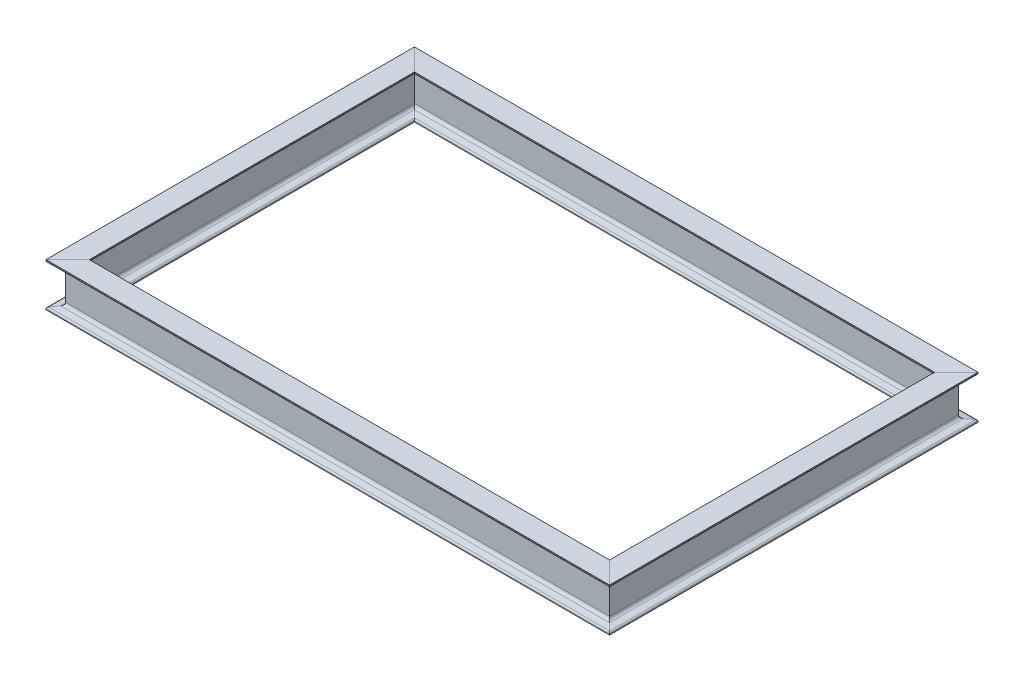
from build123d import *

# Parameters (mm, degrees)
SB_BEAM_100_X_8_1_DEPTH      = 856.901699437
SB_BEAM_100_X_8_1_DEPTH_BACK = 56.901699437
SB_BEAM_100_X_8_1_2_DEPTH    = 1363.803398875
SB_BEAM_100_X_8_1_3_DEPTH    = 913.803398875
SB_BEAM_100_X_8_1_4_DEPTH    = 1363.803398875


with BuildPart() as part:
    # Sketch11 → Sb beam 100 X 8(1) (new, two sides: drawn at the far end of the back side and taken through both)
    with BuildSketch(Plane(origin=(-625, 0, -400), x_dir=(1, 0, 0), z_dir=(0, 0, 1)).offset(-SB_BEAM_100_X_8_1_DEPTH_BACK)):
        with BuildLine():
            Line((-25, -50), (-25, -48.060671023))
            ThreePointArc((-25, -48.060671023), (-24.17058332, -45.798374682), (-22.075437296, -44.608299096))
            Line((-22.075437296, -44.608299096), (-8.099125408, -42.278743853))
            ThreePointArc((-8.099125408, -42.278743853), (-3.90883336, -39.898592681), (-2.25, -35.374))
            Line((-2.25, -35.374), (-2.25, 35.374))
            ThreePointArc((-2.25, 35.374), (-3.90883336, 39.898592681), (-8.099125408, 42.278743853))
            Line((-8.099125408, 42.278743853), (-22.075437296, 44.608299096))
            ThreePointArc((-22.075437296, 44.608299096), (-24.17058332, 45.798374682), (-25, 48.060671023))
            Line((-25, 48.060671023), (-25, 50))
            Line((-25, 50), (25, 50))
            Line((25, 50), (25, 48.060671023))
            ThreePointArc((25, 48.060671023), (24.17058332, 45.798374682), (22.075437296, 44.608299096))
            Line((22.075437296, 44.608299096), (8.099125408, 42.278743853))
            ThreePointArc((8.099125408, 42.278743853), (3.90883336, 39.898592681), (2.25, 35.374))
            Line((2.25, 35.374), (2.25, -35.374))
            ThreePointArc((2.25, -35.374), (3.90883336, -39.898592681), (8.099125408, -42.278743853))
            Line((8.099125408, -42.278743853), (22.075437296, -44.608299096))
            ThreePointArc((22.075437296, -44.608299096), (24.17058332, -45.798374682), (25, -48.060671023))
            Line((25, -48.060671023), (25, -50))
            Line((25, -50), (-25, -50))
        make_face()
    extrude(amount=SB_BEAM_100_X_8_1_DEPTH + SB_BEAM_100_X_8_1_DEPTH_BACK)

    # Sb beam 100 X 8(1) mitre 1
    split(bisect_by=Plane(origin=(-625, 0, -400), x_dir=(0, -1, 0), z_dir=(-0.707106781, 0, 0.707106781)), keep=Keep.TOP)

    # Sb beam 100 X 8(1) mitre 2
    split(bisect_by=Plane(origin=(-625, 0, 400), x_dir=(0, -1, 0), z_dir=(-0.707106781, 0, -0.707106781)), keep=Keep.TOP)


with BuildPart() as body_2:
    # Sketch11 on segment 2 (carried to segment 2) → Sb beam 100 X 8_1 2 (new body)
    with BuildSketch(Plane(origin=(-681.901699437, 0, 400), x_dir=(0, 0, -1), z_dir=(1, 0, 0))):
        with BuildLine():
            Line((-25, -50), (-25, -48.060671023))
            ThreePointArc((-25, -48.060671023), (-24.17058332, -45.798374682), (-22.075437296, -44.608299096))
            Line((-22.075437296, -44.608299096), (-8.099125408, -42.278743853))
            ThreePointArc((-8.099125408, -42.278743853), (-3.90883336, -39.898592681), (-2.25, -35.374))
            Line((-2.25, -35.374), (-2.25, 35.374))
            ThreePointArc((-2.25, 35.374), (-3.90883336, 39.898592681), (-8.099125408, 42.278743853))
            Line((-8.099125408, 42.278743853), (-22.075437296, 44.608299096))
            ThreePointArc((-22.075437296, 44.608299096), (-24.17058332, 45.798374682), (-25, 48.060671023))
            Line((-25, 48.060671023), (-25, 50))
            Line((-25, 50), (25, 50))
            Line((25, 50), (25, 48.060671023))
            ThreePointArc((25, 48.060671023), (24.17058332, 45.798374682), (22.075437296, 44.608299096))
            Line((22.075437296, 44.608299096), (8.099125408, 42.278743853))
            ThreePointArc((8.099125408, 42.278743853), (3.90883336, 39.898592681), (2.25, 35.374))
            Line((2.25, 35.374), (2.25, -35.374))
            ThreePointArc((2.25, -35.374), (3.90883336, -39.898592681), (8.099125408, -42.278743853))
            Line((8.099125408, -42.278743853), (22.075437296, -44.608299096))
            ThreePointArc((22.075437296, -44.608299096), (24.17058332, -45.798374682), (25, -48.060671023))
            Line((25, -48.060671023), (25, -50))
            Line((25, -50), (-25, -50))
        make_face()
    extrude(amount=SB_BEAM_100_X_8_1_2_DEPTH)

    # Sb beam 100 X 8_1 2 mitre 1
    split(bisect_by=Plane(origin=(-625, 0, 400), x_dir=(0, 1, 0), z_dir=(0.707106781, 0, 0.707106781)), keep=Keep.TOP)

    # Sb beam 100 X 8_1 2 mitre 2
    split(bisect_by=Plane(origin=(625, 0, 400), x_dir=(0, -1, 0), z_dir=(-0.707106781, 0, 0.707106781)), keep=Keep.TOP)


with BuildPart() as body_3:
    # Sketch11 on segment 3 (carried to segment 3) → Sb beam 100 X 8_1 3 (new body)
    with BuildSketch(Plane(origin=(625, 0, 456.901699437), x_dir=(-1, 0, 0), z_dir=(0, 0, -1))):
        with BuildLine():
            Line((-25, -50), (-25, -48.060671023))
            ThreePointArc((-25, -48.060671023), (-24.17058332, -45.798374682), (-22.075437296, -44.608299096))
            Line((-22.075437296, -44.608299096), (-8.099125408, -42.278743853))
            ThreePointArc((-8.099125408, -42.278743853), (-3.90883336, -39.898592681), (-2.25, -35.374))
            Line((-2.25, -35.374), (-2.25, 35.374))
            ThreePointArc((-2.25, 35.374), (-3.90883336, 39.898592681), (-8.099125408, 42.278743853))
            Line((-8.099125408, 42.278743853), (-22.075437296, 44.608299096))
            ThreePointArc((-22.075437296, 44.608299096), (-24.17058332, 45.798374682), (-25, 48.060671023))
            Line((-25, 48.060671023), (-25, 50))
            Line((-25, 50), (25, 50))
            Line((25, 50), (25, 48.060671023))
            ThreePointArc((25, 48.060671023), (24.17058332, 45.798374682), (22.075437296, 44.608299096))
            Line((22.075437296, 44.608299096), (8.099125408, 42.278743853))
            ThreePointArc((8.099125408, 42.278743853), (3.90883336, 39.898592681), (2.25, 35.374))
            Line((2.25, 35.374), (2.25, -35.374))
            ThreePointArc((2.25, -35.374), (3.90883336, -39.898592681), (8.099125408, -42.278743853))
            Line((8.099125408, -42.278743853), (22.075437296, -44.608299096))
            ThreePointArc((22.075437296, -44.608299096), (24.17058332, -45.798374682), (25, -48.060671023))
            Line((25, -48.060671023), (25, -50))
            Line((25, -50), (-25, -50))
        make_face()
    extrude(amount=SB_BEAM_100_X_8_1_3_DEPTH)

    # Sb beam 100 X 8_1 3 mitre 1
    split(bisect_by=Plane(origin=(625, 0, -400), x_dir=(0, 1, 0), z_dir=(0.707106781, 0, 0.707106781)), keep=Keep.TOP)

    # Sb beam 100 X 8_1 3 mitre 2
    split(bisect_by=Plane(origin=(625, 0, 400), x_dir=(0, 1, 0), z_dir=(0.707106781, 0, -0.707106781)), keep=Keep.TOP)


with BuildPart() as body_4:
    # Sketch11 on segment 4 (carried to segment 4) → Sb beam 100 X 8_1 4 (new body)
    with BuildSketch(Plane(origin=(681.901699437, 0, -400), x_dir=(0, 0, 1), z_dir=(-1, 0, 0))):
        with BuildLine():
            Line((-25, -50), (-25, -48.060671023))
            ThreePointArc((-25, -48.060671023), (-24.17058332, -45.798374682), (-22.075437296, -44.608299096))
            Line((-22.075437296, -44.608299096), (-8.099125408, -42.278743853))
            ThreePointArc((-8.099125408, -42.278743853), (-3.90883336, -39.898592681), (-2.25, -35.374))
            Line((-2.25, -35.374), (-2.25, 35.374))
            ThreePointArc((-2.25, 35.374), (-3.90883336, 39.898592681), (-8.099125408, 42.278743853))
            Line((-8.099125408, 42.278743853), (-22.075437296, 44.608299096))
            ThreePointArc((-22.075437296, 44.608299096), (-24.17058332, 45.798374682), (-25, 48.060671023))
            Line((-25, 48.060671023), (-25, 50))
            Line((-25, 50), (25, 50))
            Line((25, 50), (25, 48.060671023))
            ThreePointArc((25, 48.060671023), (24.17058332, 45.798374682), (22.075437296, 44.608299096))
            Line((22.075437296, 44.608299096), (8.099125408, 42.278743853))
            ThreePointArc((8.099125408, 42.278743853), (3.90883336, 39.898592681), (2.25, 35.374))
            Line((2.25, 35.374), (2.25, -35.374))
            ThreePointArc((2.25, -35.374), (3.90883336, -39.898592681), (8.099125408, -42.278743853))
            Line((8.099125408, -42.278743853), (22.075437296, -44.608299096))
            ThreePointArc((22.075437296, -44.608299096), (24.17058332, -45.798374682), (25, -48.060671023))
            Line((25, -48.060671023), (25, -50))
            Line((25, -50), (-25, -50))
        make_face()
    extrude(amount=SB_BEAM_100_X_8_1_4_DEPTH)

    # Sb beam 100 X 8_1 4 mitre 1
    split(bisect_by=Plane(origin=(-625, 0, -400), x_dir=(0, 1, 0), z_dir=(0.707106781, 0, -0.707106781)), keep=Keep.TOP)

    # Sb beam 100 X 8_1 4 mitre 2
    split(bisect_by=Plane(origin=(625, 0, -400), x_dir=(0, -1, 0), z_dir=(-0.707106781, 0, -0.707106781)), keep=Keep.TOP)


solid = Compound([part.part, body_2.part, body_3.part, body_4.part])
